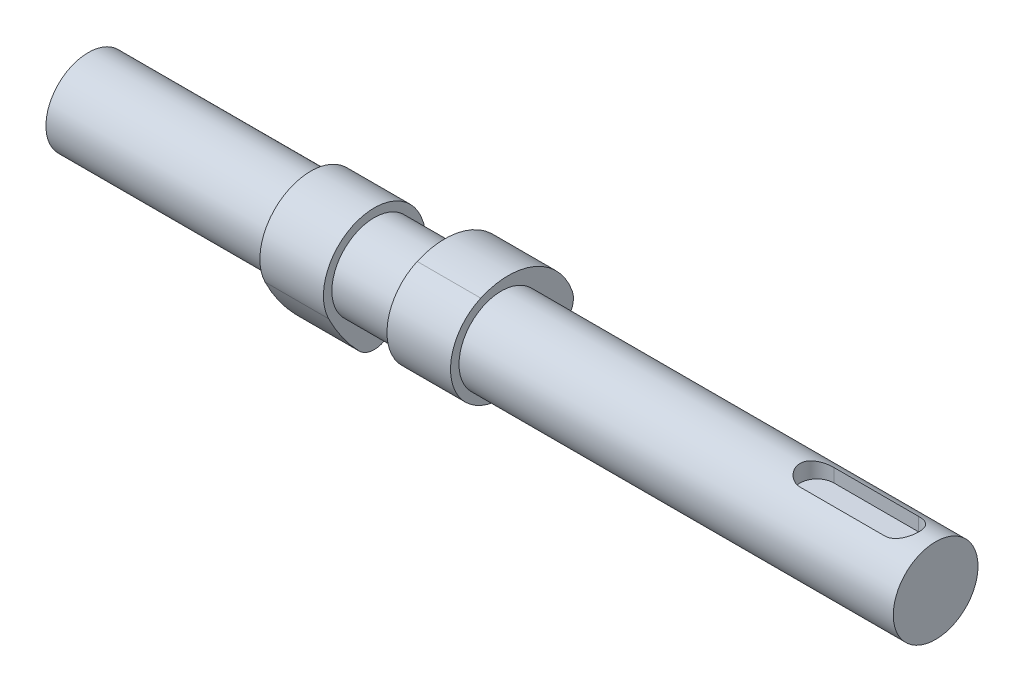
from build123d import *

# Parameters (mm, degrees)
BOSS_EXTRUDE1_DEPTH      = 125
BOSS_EXTRUDE1_DEPTH_BACK = 75
SKETCH1_R                = 10
BOSS_EXTRUDE2_START      = 15
BOSS_EXTRUDE2_DEPTH      = 7.5
BODY_MOVE_COPY1_ANGLE    = 90
CUT_EXTRUDE1_DEPTH       = 4


with BuildPart() as part:
    # Sketch1 → Boss-Extrude1 (new, two sides: drawn at the far end of the back side and taken through both)
    with BuildSketch(Plane(origin=(0, 0, 0), x_dir=(0, 0, -1), z_dir=(1, 0, 0)).offset(-BOSS_EXTRUDE1_DEPTH_BACK)):
        Circle(SKETCH1_R)
    extrude(amount=BOSS_EXTRUDE1_DEPTH + BOSS_EXTRUDE1_DEPTH_BACK)

    # Sketch3 → Cut-Extrude1 (cut)
    with BuildSketch(Plane(origin=(0, 10, 0), x_dir=(1, 0, 0), z_dir=(0, 1, 0))):
        with BuildLine():
            Line((97, 4), (117, 4))
            ThreePointArc((117, 4), (121, 0), (117, -4))
            Line((117, -4), (97, -4))
            ThreePointArc((97, -4), (93, 0), (97, 4))
        make_face()
    extrude(amount=-CUT_EXTRUDE1_DEPTH, mode=Mode.SUBTRACT)


with BuildPart() as body_2:
    # Sketch2 → Boss-Extrude2 (new, symmetric)
    with BuildSketch(Plane(origin=(0, 0, 0), x_dir=(0, 0, -1), z_dir=(1, 0, 0)).offset(BOSS_EXTRUDE2_START)):
        with BuildLine():
            ThreePointArc((-4.867089568, 10.968657125), (-10.868088345, -5.087696504), (5.306226617, -10.763083159))
            ThreePointArc((5.306226617, -10.763083159), (10.673744978, -7.573594418), (15.479542802, -3.587694386))
            ThreePointArc((15.479542802, -3.587694386), (16.864464688, -1.143374761), (16.712672037, 1.661917746))
            ThreePointArc((16.712672037, 1.661917746), (7.958571112, 11.035699457), (-4.867089568, 10.968657125))
        make_face()
    extrude(amount=BOSS_EXTRUDE2_DEPTH, both=True)


with BuildPart() as body_3:
    # Mirror1: mirrored copy
    add(body_2.part.mirror(Plane(origin=(0, 0, 0), x_dir=(0, 0, 1), z_dir=(1, 0, 0))))


with BuildPart() as body_3_1:
    # Body-Move/Copy1: moved
    add(body_3.part.rotate(Axis((0, 0, 0), (-1, 0, 0)), BODY_MOVE_COPY1_ANGLE))


with BuildPart() as part_1:
    add(part.part)

    # Combine1: union body 3, body 2
    add(body_3_1.part)
    add(body_2.part)


solid = part_1.part
